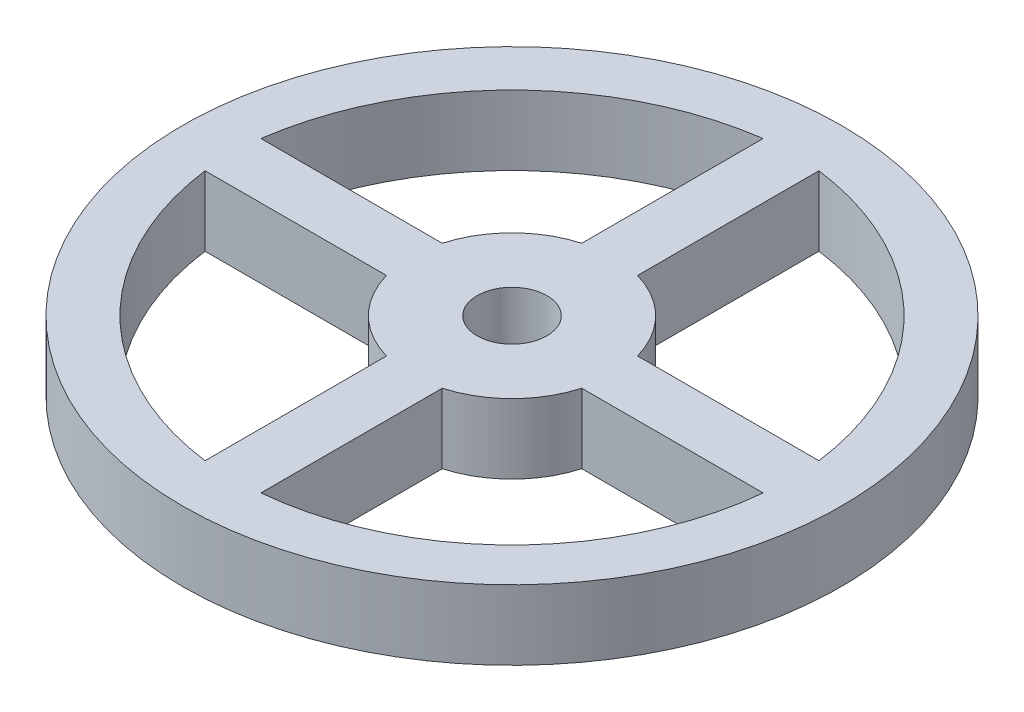
from build123d import *

# Parameters (mm, degrees)
SKETCH1_R           = 30
BOSS_EXTRUDE1_DEPTH = 6.35
SKETCH2_R           = 3.175
CUT_EXTRUDE1_DEPTH  = 43.898980174
CUT_EXTRUDE2_DEPTH  = 43.898980174


with BuildPart() as part:
    # Sketch1 → Boss-Extrude1 (new body)
    with BuildSketch(Plane(origin=(0, 0, 0), x_dir=(1, 0, 0), z_dir=(0, 1, 0))):
        with Locations(Location((0, 0, 0), (0, 0, 270))):
            Circle(SKETCH1_R)
    extrude(amount=BOSS_EXTRUDE1_DEPTH)

    # Sketch2 → Cut-Extrude1 (cut, through all)
    with BuildSketch(Plane(origin=(0, 6.35, 0), x_dir=(1, 0, 0), z_dir=(0, 1, 0))):
        with Locations(Location((0, 0, 0), (0, 0, 270))):
            Circle(SKETCH2_R)
    extrude(amount=-CUT_EXTRUDE1_DEPTH, mode=Mode.SUBTRACT)

    # Sketch3 → Cut-Extrude2 (cut, through all)
    with BuildSketch(Plane(origin=(0, 6.35, 0), x_dir=(1, 0, 0), z_dir=(0, 1, 0))):
        with BuildLine():
            Line((8.89, -2.54), (25.4, -2.54))
            ThreePointArc((25.4, -2.54), (18.076447857, -18.076447857), (2.54, -25.4))
            Line((2.54, -25.4), (2.54, -8.89))
            ThreePointArc((2.54, -8.89), (6.53772514, -6.53772514), (8.89, -2.54))
        make_face()
        with BuildLine():
            Line((-2.54, -8.89), (-2.54, -25.4))
            ThreePointArc((-2.54, -25.4), (-17.845937126, -17.845937126), (-25.4, -2.54))
            Line((-25.4, -2.54), (-8.89, -2.54))
            ThreePointArc((-8.89, -2.54), (-6.53772514, -6.53772514), (-2.54, -8.89))
        make_face()
        with BuildLine():
            Line((-8.89, 2.54), (-25.4, 2.54))
            ThreePointArc((-25.4, 2.54), (-17.794170178, 17.794170178), (-2.54, 25.4))
            Line((-2.54, 25.4), (-2.54, 8.89))
            ThreePointArc((-2.54, 8.89), (-6.53772514, 6.53772514), (-8.89, 2.54))
        make_face()
        with BuildLine():
            Line((2.54, 8.89), (2.54, 25.4))
            ThreePointArc((2.54, 25.4), (17.845937126, 17.845937126), (25.4, 2.54))
            Line((25.4, 2.54), (8.89, 2.54))
            ThreePointArc((8.89, 2.54), (6.53772514, 6.53772514), (2.54, 8.89))
        make_face()
    extrude(amount=-CUT_EXTRUDE2_DEPTH, mode=Mode.SUBTRACT)


solid = part.part
